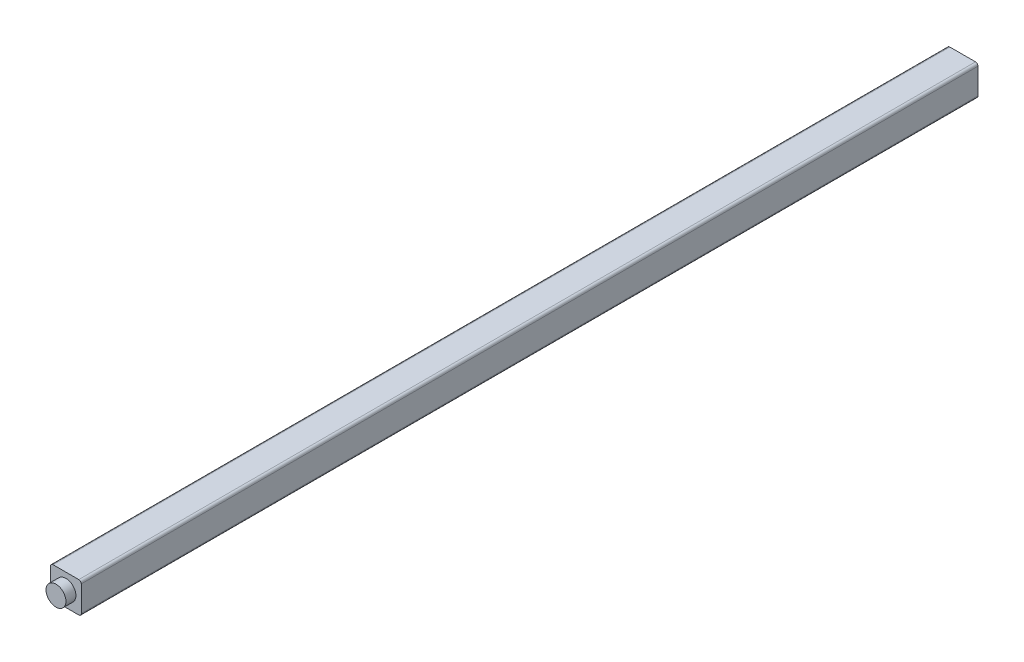
from build123d import *

# Parameters (mm, degrees)
BOSS_EXTRUDE1_DEPTH = 90
SKETCH3_R           = 1
BOSS_EXTRUDE2_DEPTH = 1


with BuildPart() as part:
    # Sketch2 → Boss-Extrude1 (new body)
    with BuildSketch(Plane.XY):
        with BuildLine():
            Line((0.25, 0), (2.83, 0))
            ThreePointArc((2.83, 0), (3.006776695, 0.073223305), (3.08, 0.25))
            Line((3.08, 0.25), (3.08, 2.83))
            ThreePointArc((3.08, 2.83), (3.006776695, 3.006776695), (2.83, 3.08))
            Line((2.83, 3.08), (0.25, 3.08))
            ThreePointArc((0.25, 3.08), (0.073223305, 3.006776695), (0, 2.83))
            Line((0, 2.83), (0, 0.25))
            ThreePointArc((0, 0.25), (0.073223305, 0.073223305), (0.25, 0))
        make_face()
    extrude(amount=BOSS_EXTRUDE1_DEPTH)

    # Sketch3 → Boss-Extrude2 (add)
    with BuildSketch(Plane.XY.offset(90)):
        with Locations(Location((1.54, 1.54, 0), (0, 0, 180))):
            Circle(SKETCH3_R)
    extrude(amount=BOSS_EXTRUDE2_DEPTH)


solid = part.part
